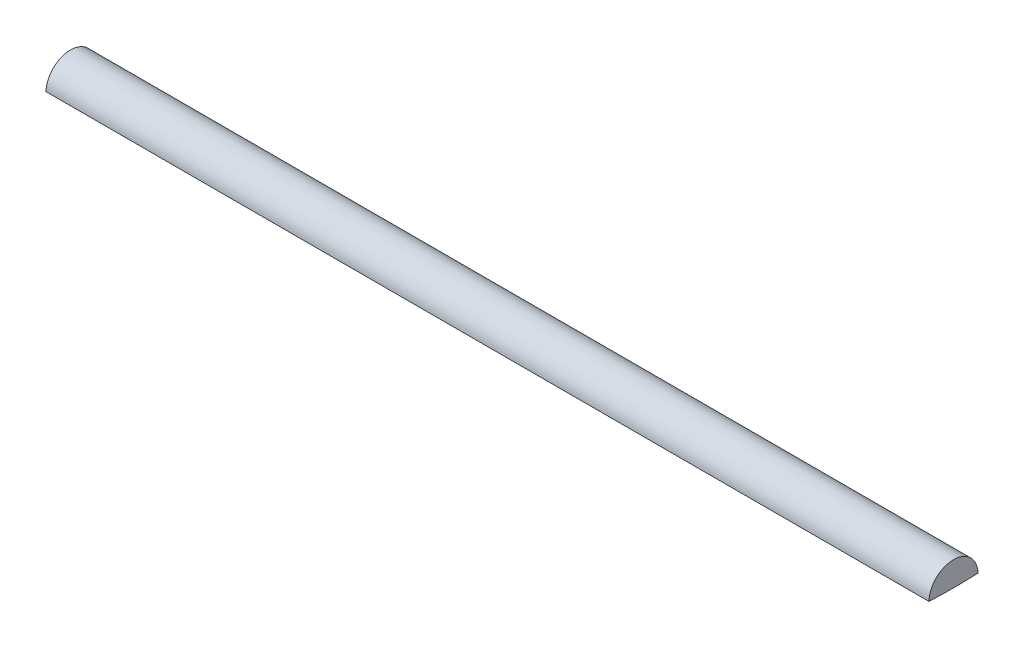
from build123d import *

# Parameters (mm, degrees)
BOSS_EXTRUDE1_DEPTH = 114.3


with BuildPart() as part:
    # Sketch1 → Boss-Extrude1 (new body)
    with BuildSketch(Plane(origin=(0, 0, 0), x_dir=(0, 0, -1), z_dir=(1, 0, 0))):
        with BuildLine():
            ThreePointArc((-3.174007657, -63.420625), (0, -63.5), (3.174007657, -63.420625))
            ThreePointArc((3.174007657, -63.420625), (0, -60.325), (-3.174007657, -63.420625))
        make_face()
    extrude(amount=BOSS_EXTRUDE1_DEPTH)


solid = part.part
